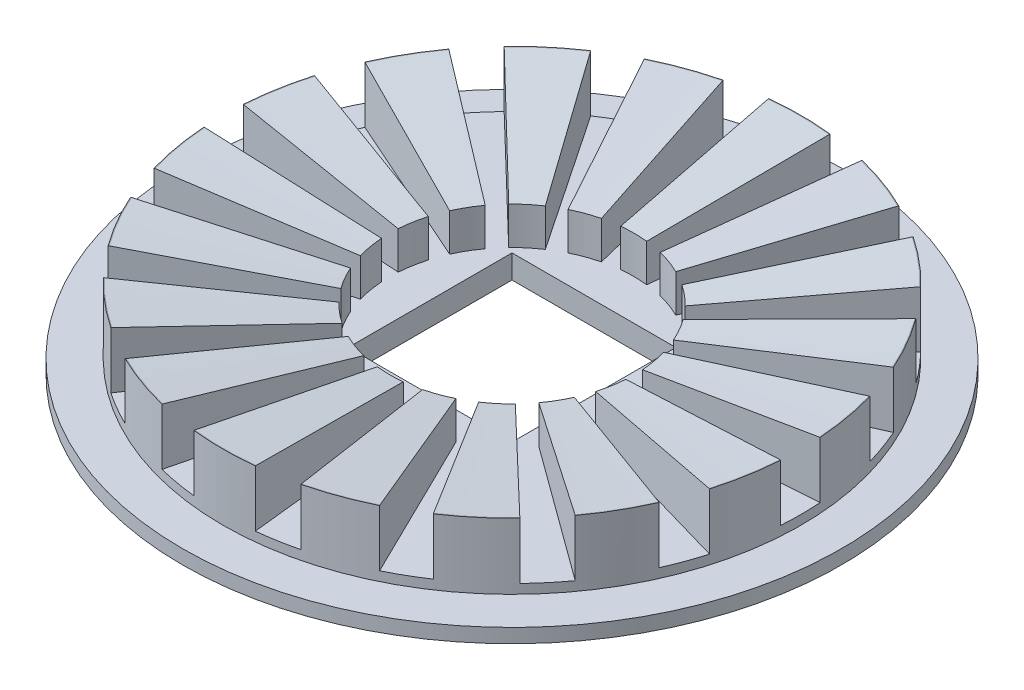
from build123d import *

# Parameters (mm, degrees)
SKETCH2_R           = 15.35
BOSS_EXTRUDE3_DEPTH = 1.25
SKETCH5_W           = 8.7
SKETCH5_H           = 8.7
CUT_EXTRUDE3_DEPTH  = 1.25
BOSS_EXTRUDE4_DEPTH = 4.25
SKETCH1_R           = 17.5
SKETCH1_R_2         = 15.35
BOSS_EXTRUDE5_DEPTH = 0.75
SKETCH8_R           = 2
SKETCH8_R_2         = 0.8
BOSS_EXTRUDE6_DEPTH = 1


with BuildPart() as part:
    # Sketch2 → Boss-Extrude3 (new body)
    with BuildSketch(Plane(origin=(0, 0, 0), x_dir=(1, 0, 0), z_dir=(0, 1, 0))):
        with Locations(Location((0, 0, 0), (0, 0, 270))):
            Circle(SKETCH2_R)
    extrude(amount=BOSS_EXTRUDE3_DEPTH)

    # Sketch5 → Cut-Extrude3 (cut)
    with BuildSketch(Plane(origin=(0, 0, 0), x_dir=(-1, 0, 0), z_dir=(0, 1, 0))):
        Rectangle(SKETCH5_W, SKETCH5_H)
    extrude(amount=CUT_EXTRUDE3_DEPTH, mode=Mode.SUBTRACT)

    # Sketch3 → Boss-Extrude4 (add)
    with BuildSketch(Plane(origin=(0, 0, 0), x_dir=(1, 0, 0), z_dir=(0, 1, 0))):
        with BuildLine():
            Line((-1.631153495, 15.263087442), (-0.690716464, 6.463196637))
            ThreePointArc((-0.690716464, 6.463196637), (0, 6.5), (0.690716464, 6.463196637))
            Line((0.690716464, 6.463196637), (1.631153495, 15.263087442))
            ThreePointArc((1.631153495, 15.263087442), (0, 15.35), (-1.631153495, 15.263087442))
        make_face()
        with BuildLine():
            Line((3.687500452, 14.900497992), (1.561482276, 6.30965713))
            ThreePointArc((1.561482276, 6.30965713), (2.223130932, 6.108002035), (2.859604604, 5.837179242))
            Line((2.859604604, 5.837179242), (6.753066257, 13.784723288))
            ThreePointArc((6.753066257, 13.784723288), (5.2500092, 14.424281729), (3.687500452, 14.900497992))
        make_face()
        with BuildLine():
            Line((8.561387423, 12.740688576), (3.625343208, 5.395079853))
            ThreePointArc((3.625343208, 5.395079853), (4.178119463, 4.97928888), (4.683582226, 4.507111884))
            Line((4.683582226, 4.507111884), (11.060459564, 10.643718064))
            ThreePointArc((11.060459564, 10.643718064), (9.866789809, 11.758782202), (8.561387423, 12.740688576))
        make_face()
        with BuildLine():
            Line((12.402644718, 9.044164085), (5.251934245, 3.829776323))
            ThreePointArc((5.251934245, 3.829776323), (5.629165125, 3.25), (5.942650709, 2.633420314))
            Line((5.942650709, 2.633420314), (14.033798213, 6.218923357))
            ThreePointArc((14.033798213, 6.218923357), (13.293489948, 7.675), (12.402644718, 9.044164085))
        make_face()
        with BuildLine():
            Line((14.747960016, 4.256779928), (6.245064502, 1.802545246))
            ThreePointArc((6.245064502, 1.802545246), (6.401250395, 1.128713155), (6.484947812, 0.442099389))
            Line((6.484947812, 0.442099389), (15.31445368, 1.044034712))
            ThreePointArc((15.31445368, 1.044034712), (15.116799009, 2.665499527), (14.747960016, 4.256779928))
        make_face()
        with BuildLine():
            Line((15.31445368, -1.044034712), (6.484947812, -0.442099389))
            ThreePointArc((6.484947812, -0.442099389), (6.401250395, -1.128713155), (6.245064502, -1.802545246))
            Line((6.245064502, -1.802545246), (14.747960016, -4.256779928))
            ThreePointArc((14.747960016, -4.256779928), (15.116799009, -2.665499527), (15.31445368, -1.044034712))
        make_face()
        with BuildLine():
            Line((14.033798213, -6.218923357), (5.942650709, -2.633420314))
            ThreePointArc((5.942650709, -2.633420314), (5.629165125, -3.25), (5.251934245, -3.829776323))
            Line((5.251934245, -3.829776323), (12.402644718, -9.044164085))
            ThreePointArc((12.402644718, -9.044164085), (13.293489948, -7.675), (14.033798213, -6.218923357))
        make_face()
        with BuildLine():
            Line((11.060459564, -10.643718064), (4.683582226, -4.507111884))
            ThreePointArc((4.683582226, -4.507111884), (4.178119463, -4.97928888), (3.625343208, -5.395079853))
            Line((3.625343208, -5.395079853), (8.561387423, -12.740688576))
            ThreePointArc((8.561387423, -12.740688576), (9.866789809, -11.758782202), (11.060459564, -10.643718064))
        make_face()
        with BuildLine():
            Line((6.753066257, -13.784723288), (2.859604604, -5.837179242))
            ThreePointArc((2.859604604, -5.837179242), (2.223130932, -6.108002035), (1.561482276, -6.30965713))
            Line((1.561482276, -6.30965713), (3.687500452, -14.900497992))
            ThreePointArc((3.687500452, -14.900497992), (5.2500092, -14.424281729), (6.753066257, -13.784723288))
        make_face()
        with BuildLine():
            Line((1.631153495, -15.263087442), (0.690716464, -6.463196637))
            ThreePointArc((0.690716464, -6.463196637), (0, -6.5), (-0.690716464, -6.463196637))
            Line((-0.690716464, -6.463196637), (-1.631153495, -15.263087442))
            ThreePointArc((-1.631153495, -15.263087442), (0, -15.35), (1.631153495, -15.263087442))
        make_face()
        with BuildLine():
            Line((-3.687500452, -14.900497992), (-1.561482276, -6.30965713))
            ThreePointArc((-1.561482276, -6.30965713), (-2.223130932, -6.108002035), (-2.859604604, -5.837179242))
            Line((-2.859604604, -5.837179242), (-6.753066257, -13.784723288))
            ThreePointArc((-6.753066257, -13.784723288), (-5.2500092, -14.424281729), (-3.687500452, -14.900497992))
        make_face()
        with BuildLine():
            Line((-8.561387423, -12.740688576), (-3.625343208, -5.395079853))
            ThreePointArc((-3.625343208, -5.395079853), (-4.178119463, -4.97928888), (-4.683582226, -4.507111884))
            Line((-4.683582226, -4.507111884), (-11.060459564, -10.643718064))
            ThreePointArc((-11.060459564, -10.643718064), (-9.866789809, -11.758782202), (-8.561387423, -12.740688576))
        make_face()
        with BuildLine():
            Line((-12.402644718, -9.044164085), (-5.251934245, -3.829776323))
            ThreePointArc((-5.251934245, -3.829776323), (-5.629165125, -3.25), (-5.942650709, -2.633420314))
            Line((-5.942650709, -2.633420314), (-14.033798213, -6.218923357))
            ThreePointArc((-14.033798213, -6.218923357), (-13.293489948, -7.675), (-12.402644718, -9.044164085))
        make_face()
        with BuildLine():
            Line((-14.747960016, -4.256779928), (-6.245064502, -1.802545246))
            ThreePointArc((-6.245064502, -1.802545246), (-6.401250395, -1.128713155), (-6.484947812, -0.442099389))
            Line((-6.484947812, -0.442099389), (-15.31445368, -1.044034712))
            ThreePointArc((-15.31445368, -1.044034712), (-15.116799009, -2.665499527), (-14.747960016, -4.256779928))
        make_face()
        with BuildLine():
            Line((-15.31445368, 1.044034712), (-6.484947812, 0.442099389))
            ThreePointArc((-6.484947812, 0.442099389), (-6.401250395, 1.128713155), (-6.245064502, 1.802545246))
            Line((-6.245064502, 1.802545246), (-14.747960016, 4.256779928))
            ThreePointArc((-14.747960016, 4.256779928), (-15.116799009, 2.665499527), (-15.31445368, 1.044034712))
        make_face()
        with BuildLine():
            Line((-14.033798213, 6.218923357), (-5.942650709, 2.633420314))
            ThreePointArc((-5.942650709, 2.633420314), (-5.629165125, 3.25), (-5.251934245, 3.829776323))
            Line((-5.251934245, 3.829776323), (-12.402644718, 9.044164085))
            ThreePointArc((-12.402644718, 9.044164085), (-13.293489948, 7.675), (-14.033798213, 6.218923357))
        make_face()
        with BuildLine():
            Line((-11.060459564, 10.643718064), (-4.683582226, 4.507111884))
            ThreePointArc((-4.683582226, 4.507111884), (-4.178119463, 4.97928888), (-3.625343208, 5.395079853))
            Line((-3.625343208, 5.395079853), (-8.561387423, 12.740688576))
            ThreePointArc((-8.561387423, 12.740688576), (-9.866789809, 11.758782202), (-11.060459564, 10.643718064))
        make_face()
        with BuildLine():
            Line((-6.753066257, 13.784723288), (-2.859604604, 5.837179242))
            ThreePointArc((-2.859604604, 5.837179242), (-2.223130932, 6.108002035), (-1.561482276, 6.30965713))
            Line((-1.561482276, 6.30965713), (-3.687500452, 14.900497992))
            ThreePointArc((-3.687500452, 14.900497992), (-5.2500092, 14.424281729), (-6.753066257, 13.784723288))
        make_face()
    extrude(amount=BOSS_EXTRUDE4_DEPTH)

    # Sketch7 → Cut-Revolve1 (revolve, cut)
    with BuildSketch(Plane.XY, mode=Mode.PRIVATE) as cut_revolve1_sk:
        Polygon((6.5, 3.25), (15.31445368, 4.25), (6.5, 4.25), align=None)
    revolve(cut_revolve1_sk.sketch.rotate(Axis((0, 3.25, 0), (0, 1, 0)), 83.9), axis=Axis((0, 3.25, 0), (0, 1, 0)), mode=Mode.SUBTRACT)

    # Sketch1 → Boss-Extrude5 (add)
    with BuildSketch(Plane(origin=(0, 0, 0), x_dir=(1, 0, 0), z_dir=(0, 1, 0))):
        with Locations(Location((0, 0, 0), (0, 0, 270))):
            Circle(SKETCH1_R)
        with Locations(Location((0, 0, 0), (0, 0, 83.9))):
            Circle(SKETCH1_R_2, mode=Mode.SUBTRACT)
    extrude(amount=BOSS_EXTRUDE5_DEPTH)

    # Sketch8 → Boss-Extrude6 (add)
    # profile 1 of 2: a face of its own
    with BuildSketch(Plane(origin=(0, 0, 0), x_dir=(1, 0, 0), z_dir=(0, 1, 0))):
        with Locations(Location((-10.8, 0, 0), (0, 0, 270))):
            Circle(SKETCH8_R)
        with Locations(Location((-10.8, 0, 0), (0, 0, 270))):
            Circle(SKETCH8_R_2, mode=Mode.SUBTRACT)
    # profile 2 of 2: a face of its own
    with BuildSketch(Plane(origin=(0, 0, 0), x_dir=(1, 0, 0), z_dir=(0, 1, 0))):
        with Locations(Location((10.8, 0, 0), (0, 0, 90))):
            Circle(SKETCH8_R)
        with Locations(Location((10.8, 0, 0), (0, 0, 270))):
            Circle(SKETCH8_R_2, mode=Mode.SUBTRACT)
    extrude(amount=-BOSS_EXTRUDE6_DEPTH)


solid = part.part
